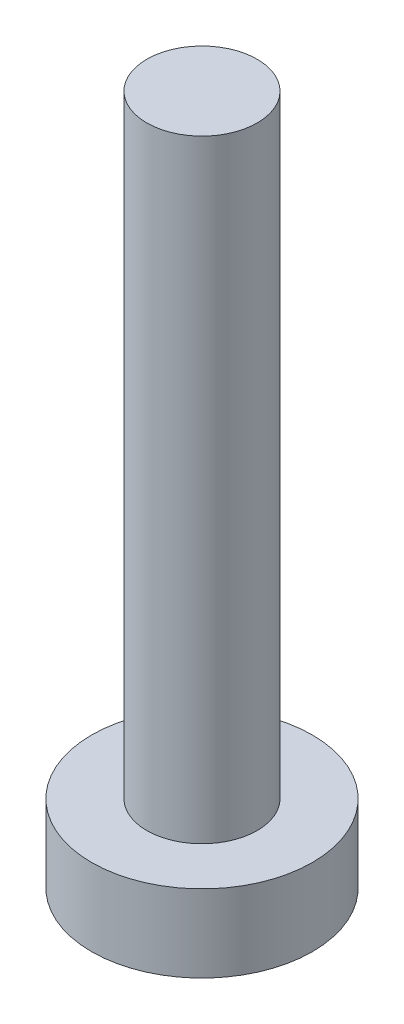
from build123d import *

# Parameters (mm, degrees)
SKETCH1_R           = 4
SKETCH1_R_2         = 2
BOSS_EXTRUDE1_DEPTH = 2.8
BOSS_EXTRUDE2_START = 2.8
SKETCH1_3_R         = 2
BOSS_EXTRUDE2_DEPTH = 22.2


with BuildPart() as part:
    # Sketch1 → Boss-Extrude1 (new body)
    # profile 1 of 2: a face of its own
    with BuildSketch(Plane(origin=(0, 0, 0), x_dir=(1, 0, 0), z_dir=(0, 1, 0))):
        with Locations(Location((0, 0, 0), (0, 0, 270))):
            Circle(SKETCH1_R)
        Circle(SKETCH1_R_2, mode=Mode.SUBTRACT)
    # profile 2 of 2: a face of its own
    with BuildSketch(Plane(origin=(0, 0, 0), x_dir=(1, 0, 0), z_dir=(0, 1, 0))):
        Circle(SKETCH1_R_2)
    extrude(amount=BOSS_EXTRUDE1_DEPTH)

    # Sketch1<3> → Boss-Extrude2 (add)
    with BuildSketch(Plane(origin=(0, 0, 0), x_dir=(1, 0, 0), z_dir=(0, 1, 0)).offset(BOSS_EXTRUDE2_START)):
        with Locations(Location((0, 0, 0), (0, 0, 270))):
            Circle(SKETCH1_3_R)
    extrude(amount=BOSS_EXTRUDE2_DEPTH)


solid = part.part
